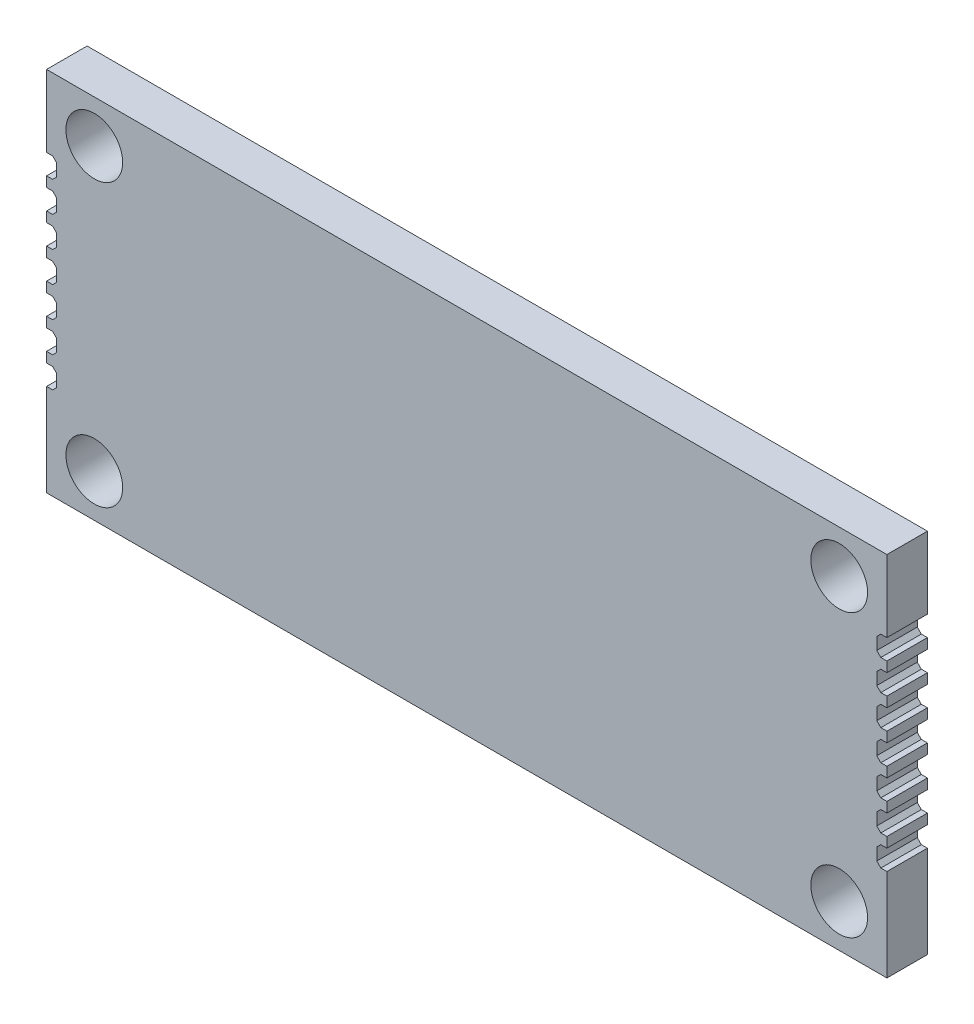
from build123d import *

# Parameters (mm, degrees)
SKETCH_1_W          = 41.47467615
SKETCH_1_H          = 18.100023376
EXTRUDE_1_DEPTH     = 2
CUT_EXTRUDE_1_REACH = 26.88
SKETCH_2_R          = 1.4
CUT_EXTRUDE_2_REACH = 26.88


with BuildPart() as part:
    # 草图1 → 凸台-拉伸1 (new body)
    with BuildSketch(Plane.XY):
        with Locations((0, 4.550011688)):
            Rectangle(SKETCH_1_W, SKETCH_1_H)
    extrude(amount=EXTRUDE_1_DEPTH)

    # 草图2 → 切除-拉伸1 (cut, up to next)
    with BuildSketch(Plane.XY.offset(2), mode=Mode.PRIVATE) as cut_extrude_1_sk1:
        with Locations((-18.383061341, -2.4)):
            Circle(SKETCH_2_R)
    cut_extrude_1_tool1 = extrude(cut_extrude_1_sk1.sketch, amount=-CUT_EXTRUDE_1_REACH, mode=Mode.PRIVATE) & part.part
    # 草图2 → 切除-拉伸1 (cut, up to next)
    with BuildSketch(Plane.XY.offset(2), mode=Mode.PRIVATE) as cut_extrude_1_sk2:
        with Locations(Location((18.383061341, -2.4, 0), (0, 0, 180))):
            Circle(SKETCH_2_R)
    cut_extrude_1_tool2 = extrude(cut_extrude_1_sk2.sketch, amount=-CUT_EXTRUDE_1_REACH, mode=Mode.PRIVATE) & part.part
    # 草图2 → 切除-拉伸1 (cut, up to next)
    with BuildSketch(Plane.XY.offset(2), mode=Mode.PRIVATE) as cut_extrude_1_sk3:
        with Locations((18.383061341, 11.500023376)):
            Circle(SKETCH_2_R)
    cut_extrude_1_tool3 = extrude(cut_extrude_1_sk3.sketch, amount=-CUT_EXTRUDE_1_REACH, mode=Mode.PRIVATE) & part.part
    # 草图2 → 切除-拉伸1 (cut, up to next)
    with BuildSketch(Plane.XY.offset(2), mode=Mode.PRIVATE) as cut_extrude_1_sk4:
        with Locations(Location((-18.383061341, 11.500023376, 0), (0, 0, 180))):
            Circle(SKETCH_2_R)
    cut_extrude_1_tool4 = extrude(cut_extrude_1_sk4.sketch, amount=-CUT_EXTRUDE_1_REACH, mode=Mode.PRIVATE) & part.part
    add(cut_extrude_1_tool1.solids().sort_by_distance((-18.383061, -2.4, 2))[0], mode=Mode.SUBTRACT)
    add(cut_extrude_1_tool2.solids().sort_by_distance((18.383061, -2.4, 2))[0], mode=Mode.SUBTRACT)
    add(cut_extrude_1_tool3.solids().sort_by_distance((18.383061, 11.500023, 2))[0], mode=Mode.SUBTRACT)
    add(cut_extrude_1_tool4.solids().sort_by_distance((-18.383061, 11.500023, 2))[0], mode=Mode.SUBTRACT)

    # 草图3 → 切除-拉伸2 (cut, up to next)
    with BuildSketch(Plane(origin=(0, 0, 0), x_dir=(-1, 0, 0), z_dir=(0, 0, -1)), mode=Mode.PRIVATE) as cut_extrude_2_sk1:
        Polygon((-20.737338075, 1.050011688), (-20.437338075, 1.050011688), (-20.237338075, 0.850011688), (-20.237338075, 0.250011688), (-20.437338075, 0.050011688), (-20.737338075, 0.050011688), align=None)
    cut_extrude_2_tool1 = extrude(cut_extrude_2_sk1.sketch, amount=-CUT_EXTRUDE_2_REACH, mode=Mode.PRIVATE) & part.part
    # 草图3 → 切除-拉伸2 (cut, up to next)
    with BuildSketch(Plane(origin=(0, 0, 0), x_dir=(-1, 0, 0), z_dir=(0, 0, -1)), mode=Mode.PRIVATE) as cut_extrude_2_sk2:
        Polygon((-20.737338075, 2.550011688), (-20.437338075, 2.550011688), (-20.237338075, 2.350011688), (-20.237338075, 1.750011688), (-20.437338075, 1.550011688), (-20.737338075, 1.550011688), align=None)
    cut_extrude_2_tool2 = extrude(cut_extrude_2_sk2.sketch, amount=-CUT_EXTRUDE_2_REACH, mode=Mode.PRIVATE) & part.part
    # 草图3 → 切除-拉伸2 (cut, up to next)
    with BuildSketch(Plane(origin=(0, 0, 0), x_dir=(-1, 0, 0), z_dir=(0, 0, -1)), mode=Mode.PRIVATE) as cut_extrude_2_sk3:
        Polygon((-20.737338075, 4.050011688), (-20.437338075, 4.050011688), (-20.237338075, 3.850011688), (-20.237338075, 3.250011688), (-20.437338075, 3.050011688), (-20.737338075, 3.050011688), align=None)
    cut_extrude_2_tool3 = extrude(cut_extrude_2_sk3.sketch, amount=-CUT_EXTRUDE_2_REACH, mode=Mode.PRIVATE) & part.part
    # 草图3 → 切除-拉伸2 (cut, up to next)
    with BuildSketch(Plane(origin=(0, 0, 0), x_dir=(-1, 0, 0), z_dir=(0, 0, -1)), mode=Mode.PRIVATE) as cut_extrude_2_sk4:
        Polygon((-20.737338075, 5.550011688), (-20.437338075, 5.550011688), (-20.237338075, 5.350011688), (-20.237338075, 4.750011688), (-20.437338075, 4.550011688), (-20.737338075, 4.550011688), align=None)
    cut_extrude_2_tool4 = extrude(cut_extrude_2_sk4.sketch, amount=-CUT_EXTRUDE_2_REACH, mode=Mode.PRIVATE) & part.part
    # 草图3 → 切除-拉伸2 (cut, up to next)
    with BuildSketch(Plane(origin=(0, 0, 0), x_dir=(-1, 0, 0), z_dir=(0, 0, -1)), mode=Mode.PRIVATE) as cut_extrude_2_sk5:
        Polygon((-20.737338075, 7.050011688), (-20.437338075, 7.050011688), (-20.237338075, 6.850011688), (-20.237338075, 6.250011688), (-20.437338075, 6.050011688), (-20.737338075, 6.050011688), align=None)
    cut_extrude_2_tool5 = extrude(cut_extrude_2_sk5.sketch, amount=-CUT_EXTRUDE_2_REACH, mode=Mode.PRIVATE) & part.part
    # 草图3 → 切除-拉伸2 (cut, up to next)
    with BuildSketch(Plane(origin=(0, 0, 0), x_dir=(-1, 0, 0), z_dir=(0, 0, -1)), mode=Mode.PRIVATE) as cut_extrude_2_sk6:
        Polygon((-20.737338075, 8.550011688), (-20.437338075, 8.550011688), (-20.237338075, 8.350011688), (-20.237338075, 7.750011688), (-20.437338075, 7.550011688), (-20.737338075, 7.550011688), align=None)
    cut_extrude_2_tool6 = extrude(cut_extrude_2_sk6.sketch, amount=-CUT_EXTRUDE_2_REACH, mode=Mode.PRIVATE) & part.part
    # 草图3 → 切除-拉伸2 (cut, up to next)
    with BuildSketch(Plane(origin=(0, 0, 0), x_dir=(-1, 0, 0), z_dir=(0, 0, -1)), mode=Mode.PRIVATE) as cut_extrude_2_sk7:
        Polygon((-20.737338075, 10.050011688), (-20.437338075, 10.050011688), (-20.237338075, 9.850011688), (-20.237338075, 9.250011688), (-20.437338075, 9.050011688), (-20.737338075, 9.050011688), align=None)
    cut_extrude_2_tool7 = extrude(cut_extrude_2_sk7.sketch, amount=-CUT_EXTRUDE_2_REACH, mode=Mode.PRIVATE) & part.part
    # 草图3 → 切除-拉伸2 (cut, up to next)
    with BuildSketch(Plane(origin=(0, 0, 0), x_dir=(-1, 0, 0), z_dir=(0, 0, -1)), mode=Mode.PRIVATE) as cut_extrude_2_sk8:
        Polygon((20.737338075, 3.050011688), (20.737338075, 4.050011688), (20.437338075, 4.050011688), (20.237338075, 3.850011688), (20.237338075, 3.250011688), (20.437338075, 3.050011688), align=None)
    cut_extrude_2_tool8 = extrude(cut_extrude_2_sk8.sketch, amount=-CUT_EXTRUDE_2_REACH, mode=Mode.PRIVATE) & part.part
    # 草图3 → 切除-拉伸2 (cut, up to next)
    with BuildSketch(Plane(origin=(0, 0, 0), x_dir=(-1, 0, 0), z_dir=(0, 0, -1)), mode=Mode.PRIVATE) as cut_extrude_2_sk9:
        Polygon((20.737338075, 1.550011688), (20.737338075, 2.550011688), (20.437338075, 2.550011688), (20.237338075, 2.350011688), (20.237338075, 1.750011688), (20.437338075, 1.550011688), align=None)
    cut_extrude_2_tool9 = extrude(cut_extrude_2_sk9.sketch, amount=-CUT_EXTRUDE_2_REACH, mode=Mode.PRIVATE) & part.part
    # 草图3 → 切除-拉伸2 (cut, up to next)
    with BuildSketch(Plane(origin=(0, 0, 0), x_dir=(-1, 0, 0), z_dir=(0, 0, -1)), mode=Mode.PRIVATE) as cut_extrude_2_sk10:
        Polygon((20.737338075, 4.550011688), (20.737338075, 5.550011688), (20.437338075, 5.550011688), (20.237338075, 5.350011688), (20.237338075, 4.750011688), (20.437338075, 4.550011688), align=None)
    cut_extrude_2_tool10 = extrude(cut_extrude_2_sk10.sketch, amount=-CUT_EXTRUDE_2_REACH, mode=Mode.PRIVATE) & part.part
    # 草图3 → 切除-拉伸2 (cut, up to next)
    with BuildSketch(Plane(origin=(0, 0, 0), x_dir=(-1, 0, 0), z_dir=(0, 0, -1)), mode=Mode.PRIVATE) as cut_extrude_2_sk11:
        Polygon((20.737338075, 6.050011688), (20.737338075, 7.050011688), (20.437338075, 7.050011688), (20.237338075, 6.850011688), (20.237338075, 6.250011688), (20.437338075, 6.050011688), align=None)
    cut_extrude_2_tool11 = extrude(cut_extrude_2_sk11.sketch, amount=-CUT_EXTRUDE_2_REACH, mode=Mode.PRIVATE) & part.part
    # 草图3 → 切除-拉伸2 (cut, up to next)
    with BuildSketch(Plane(origin=(0, 0, 0), x_dir=(-1, 0, 0), z_dir=(0, 0, -1)), mode=Mode.PRIVATE) as cut_extrude_2_sk12:
        Polygon((20.737338075, 7.550011688), (20.737338075, 8.550011688), (20.437338075, 8.550011688), (20.237338075, 8.350011688), (20.237338075, 7.750011688), (20.437338075, 7.550011688), align=None)
    cut_extrude_2_tool12 = extrude(cut_extrude_2_sk12.sketch, amount=-CUT_EXTRUDE_2_REACH, mode=Mode.PRIVATE) & part.part
    # 草图3 → 切除-拉伸2 (cut, up to next)
    with BuildSketch(Plane(origin=(0, 0, 0), x_dir=(-1, 0, 0), z_dir=(0, 0, -1)), mode=Mode.PRIVATE) as cut_extrude_2_sk13:
        Polygon((20.737338075, 9.050011688), (20.737338075, 10.050011688), (20.437338075, 10.050011688), (20.237338075, 9.850011688), (20.237338075, 9.250011688), (20.437338075, 9.050011688), align=None)
    cut_extrude_2_tool13 = extrude(cut_extrude_2_sk13.sketch, amount=-CUT_EXTRUDE_2_REACH, mode=Mode.PRIVATE) & part.part
    # 草图3 → 切除-拉伸2 (cut, up to next)
    with BuildSketch(Plane(origin=(0, 0, 0), x_dir=(-1, 0, 0), z_dir=(0, 0, -1)), mode=Mode.PRIVATE) as cut_extrude_2_sk14:
        Polygon((20.737338075, 0.050011688), (20.737338075, 1.050011688), (20.437338075, 1.050011688), (20.237338075, 0.850011688), (20.237338075, 0.250011688), (20.437338075, 0.050011688), align=None)
    cut_extrude_2_tool14 = extrude(cut_extrude_2_sk14.sketch, amount=-CUT_EXTRUDE_2_REACH, mode=Mode.PRIVATE) & part.part
    add(cut_extrude_2_tool1.solids().sort_by_distance((20.50328, 0.550012, 0))[0], mode=Mode.SUBTRACT)
    add(cut_extrude_2_tool2.solids().sort_by_distance((20.50328, 2.050012, 0))[0], mode=Mode.SUBTRACT)
    add(cut_extrude_2_tool3.solids().sort_by_distance((20.50328, 3.550012, 0))[0], mode=Mode.SUBTRACT)
    add(cut_extrude_2_tool4.solids().sort_by_distance((20.50328, 5.050012, 0))[0], mode=Mode.SUBTRACT)
    add(cut_extrude_2_tool5.solids().sort_by_distance((20.50328, 6.550012, 0))[0], mode=Mode.SUBTRACT)
    add(cut_extrude_2_tool6.solids().sort_by_distance((20.50328, 8.050012, 0))[0], mode=Mode.SUBTRACT)
    add(cut_extrude_2_tool7.solids().sort_by_distance((20.50328, 9.550012, 0))[0], mode=Mode.SUBTRACT)
    add(cut_extrude_2_tool8.solids().sort_by_distance((-20.50328, 3.550012, 0))[0], mode=Mode.SUBTRACT)
    add(cut_extrude_2_tool9.solids().sort_by_distance((-20.50328, 2.050012, 0))[0], mode=Mode.SUBTRACT)
    add(cut_extrude_2_tool10.solids().sort_by_distance((-20.50328, 5.050012, 0))[0], mode=Mode.SUBTRACT)
    add(cut_extrude_2_tool11.solids().sort_by_distance((-20.50328, 6.550012, 0))[0], mode=Mode.SUBTRACT)
    add(cut_extrude_2_tool12.solids().sort_by_distance((-20.50328, 8.050012, 0))[0], mode=Mode.SUBTRACT)
    add(cut_extrude_2_tool13.solids().sort_by_distance((-20.50328, 9.550012, 0))[0], mode=Mode.SUBTRACT)
    add(cut_extrude_2_tool14.solids().sort_by_distance((-20.50328, 0.550012, 0))[0], mode=Mode.SUBTRACT)


solid = part.part
